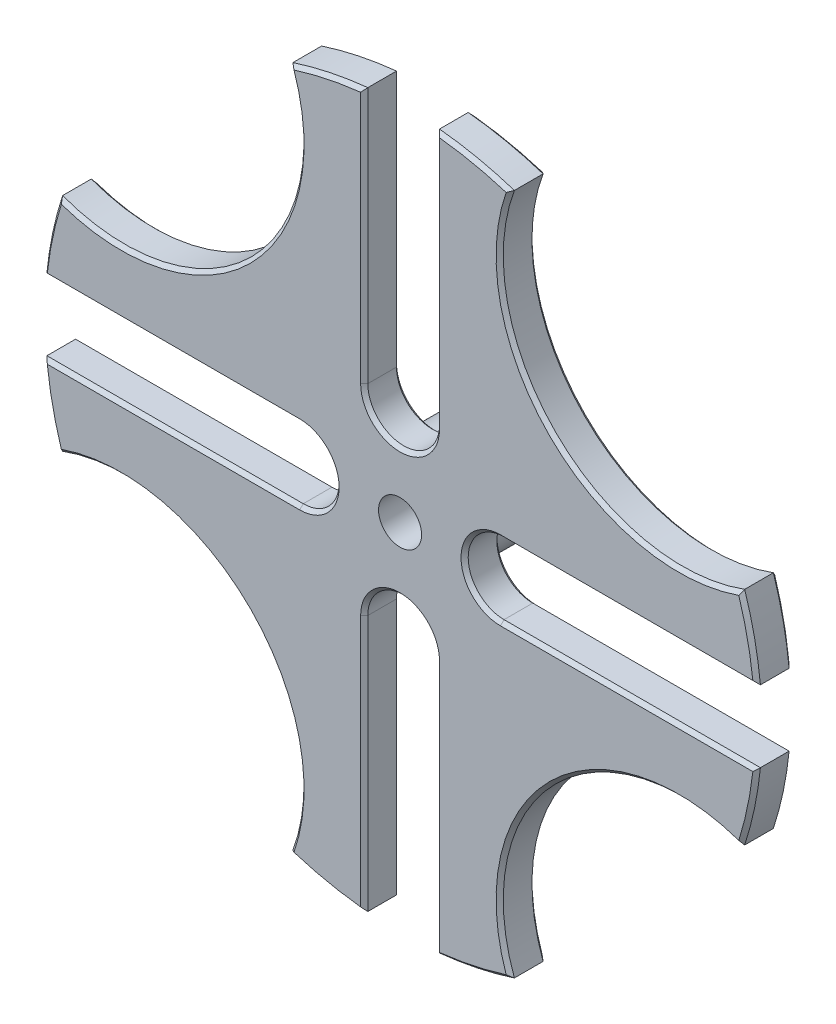
from build123d import *

# Parameters (mm, degrees)
SKETCH1_R                = 50
SKETCH1_R_2              = 3
BOSS_EXTRUDE1_DEPTH      = 5
SKETCH2_R                = 25
CUT_EXTRUDE1_DEPTH       = 71.887234394
CHAMFER1_SIZE            = 0.5
BOSS_EXTRUDE3_DEPTH      = 10
BOSS_EXTRUDE3_DEPTH_BACK = 5
SKETCH4_R                = 7.5
SKETCH4_R_2              = 3
CHAMFER2_SIZE            = 0.5


with BuildPart() as part:
    # Sketch1 → Boss-Extrude1 (new body)
    with BuildSketch(Plane.XY):
        Circle(SKETCH1_R)
        Circle(SKETCH1_R_2, mode=Mode.SUBTRACT)
    extrude(amount=BOSS_EXTRUDE1_DEPTH)

    # Sketch2 → Cut-Extrude1 (cut, through all)
    with BuildSketch(Plane.XY.offset(5)):
        with Locations((38.890872965, 38.890872965)):
            Circle(SKETCH2_R)
        with Locations((38.890872965, -38.890872965)):
            Circle(SKETCH2_R)
        with Locations((-38.890872965, -38.890872965)):
            Circle(SKETCH2_R)
        with Locations((-38.890872965, 38.890872965)):
            Circle(SKETCH2_R)
        with BuildLine():
            Line((-5, 14), (-5, 86))
            ThreePointArc((-5, 86), (0, 91), (5, 86))
            Line((5, 86), (5, 14))
            ThreePointArc((5, 14), (0, 9), (-5, 14))
        make_face()
        with BuildLine():
            Line((14, 5), (86, 5))
            ThreePointArc((86, 5), (91, 0), (86, -5))
            Line((86, -5), (14, -5))
            ThreePointArc((14, -5), (9, 0), (14, 5))
        make_face()
        with BuildLine():
            Line((5, -14), (5, -86))
            ThreePointArc((5, -86), (0, -91), (-5, -86))
            Line((-5, -86), (-5, -14))
            ThreePointArc((-5, -14), (0, -9), (5, -14))
        make_face()
        with BuildLine():
            Line((-14, -5), (-86, -5))
            ThreePointArc((-86, -5), (-91, 0), (-86, 5))
            Line((-86, 5), (-14, 5))
            ThreePointArc((-14, 5), (-9, 0), (-14, -5))
        make_face()
    extrude(amount=-CUT_EXTRUDE1_DEPTH, mode=Mode.SUBTRACT)

    # Chamfer1
    chamfer1_edges = [part.edges().sort_by_distance(p)[0] for p in [
        (-10.27898673, 48.932018473, 0),
        (-5, 31.874685928, 0),
        (5, 31.874685928, 0),
        (5, 31.874685928, 5),
        (-5, 31.874685928, 5),
        (0, 9, 5),
        (0, 9, 0),
        (-48.932018473, 10.27898673, 5),
        (-48.932018473, -10.27898673, 5),
        (-10.27898673, -48.932018473, 5),
        (10.27898673, -48.932018473, 5),
        (48.932018473, -10.27898673, 5),
        (48.932018473, 10.27898673, 5),
        (10.27898673, 48.932018473, 5),
        (-48.932018473, 10.27898673, 0),
        (-48.932018473, -10.27898673, 0),
        (-10.27898673, -48.932018473, 0),
        (10.27898673, -48.932018473, 0),
        (48.932018473, -10.27898673, 0),
        (48.932018473, 10.27898673, 0),
        (10.27898673, 48.932018473, 0),
        (-3, 0, 0),
        (-3, 0, 5),
        (-31.874685928, -5, 0),
        (-31.874685928, 5, 0),
        (-31.874685928, 5, 5),
        (-31.874685928, -5, 5),
        (-9, 0, 5),
        (-9, 0, 0),
        (21.213203436, -21.213203436, 0),
        (21.213203436, -21.213203436, 5),
        (-21.213203436, -21.213203436, 0),
        (-21.213203436, -21.213203436, 5),
        (-21.213203436, 21.213203436, 0),
        (-21.213203436, 21.213203436, 5),
        (5, -31.874685928, 0),
        (-5, -31.874685928, 0),
        (-5, -31.874685928, 5),
        (5, -31.874685928, 5),
        (0, -9, 5),
        (0, -9, 0),
        (31.874685928, 5, 0),
        (31.874685928, -5, 0),
        (31.874685928, -5, 5),
        (31.874685928, 5, 5),
        (9, 0, 5),
        (9, 0, 0),
        (21.213203436, 21.213203436, 0),
        (21.213203436, 21.213203436, 5),
        (-10.27898673, 48.932018473, 5),
    ]]
    chamfer(chamfer1_edges, length=CHAMFER1_SIZE)

    # Sketch4 → Boss-Extrude3 (add, two sides: drawn at the far end of the back side and taken through both)
    with BuildSketch(Plane(origin=(0, 0, 0), x_dir=(-1, 0, 0), z_dir=(0, 0, -1)).offset(-BOSS_EXTRUDE3_DEPTH_BACK)):
        Circle(SKETCH4_R)
        Circle(SKETCH4_R_2, mode=Mode.SUBTRACT)
    extrude(amount=BOSS_EXTRUDE3_DEPTH + BOSS_EXTRUDE3_DEPTH_BACK)

    # Chamfer2
    chamfer2_edges = [part.edges().sort_by_distance(p)[0] for p in [
        (3, 0, -10),
        (7.5, 0, -10),
    ]]
    chamfer(chamfer2_edges, length=CHAMFER2_SIZE)


solid = part.part
